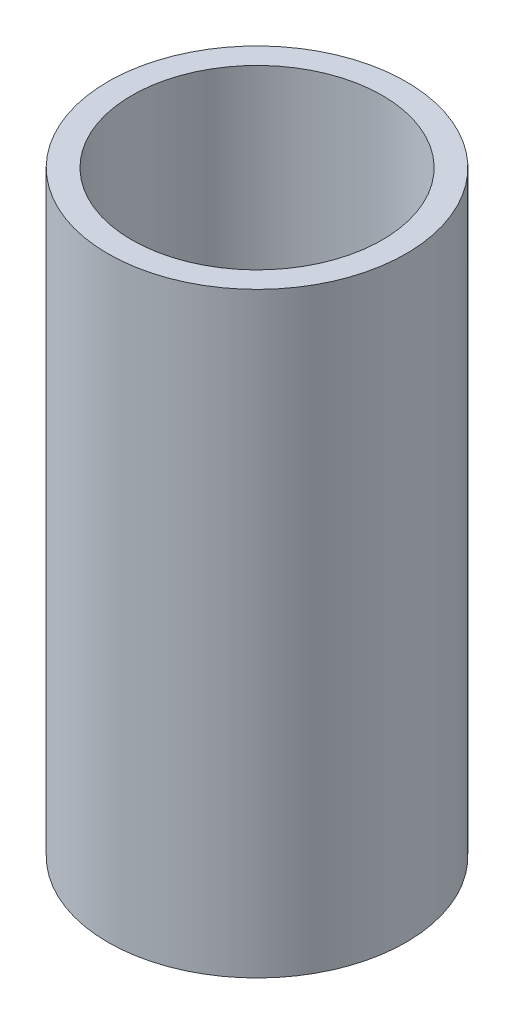
from build123d import *

# Parameters (mm, degrees)
SKETCH1_R           = 12.5
SKETCH1_R_2         = 10.5
BOSS_EXTRUDE1_DEPTH = 25


with BuildPart() as part:
    # Sketch1 → Boss-Extrude1 (new, symmetric)
    with BuildSketch(Plane(origin=(0, 0, 0), x_dir=(1, 0, 0), z_dir=(0, 1, 0))):
        with Locations(Location((0, 0, 0), (0, 0, 270))):
            Circle(SKETCH1_R)
        with Locations(Location((0, 0, 0), (0, 0, 270))):
            Circle(SKETCH1_R_2, mode=Mode.SUBTRACT)
    extrude(amount=BOSS_EXTRUDE1_DEPTH, both=True)


solid = part.part
